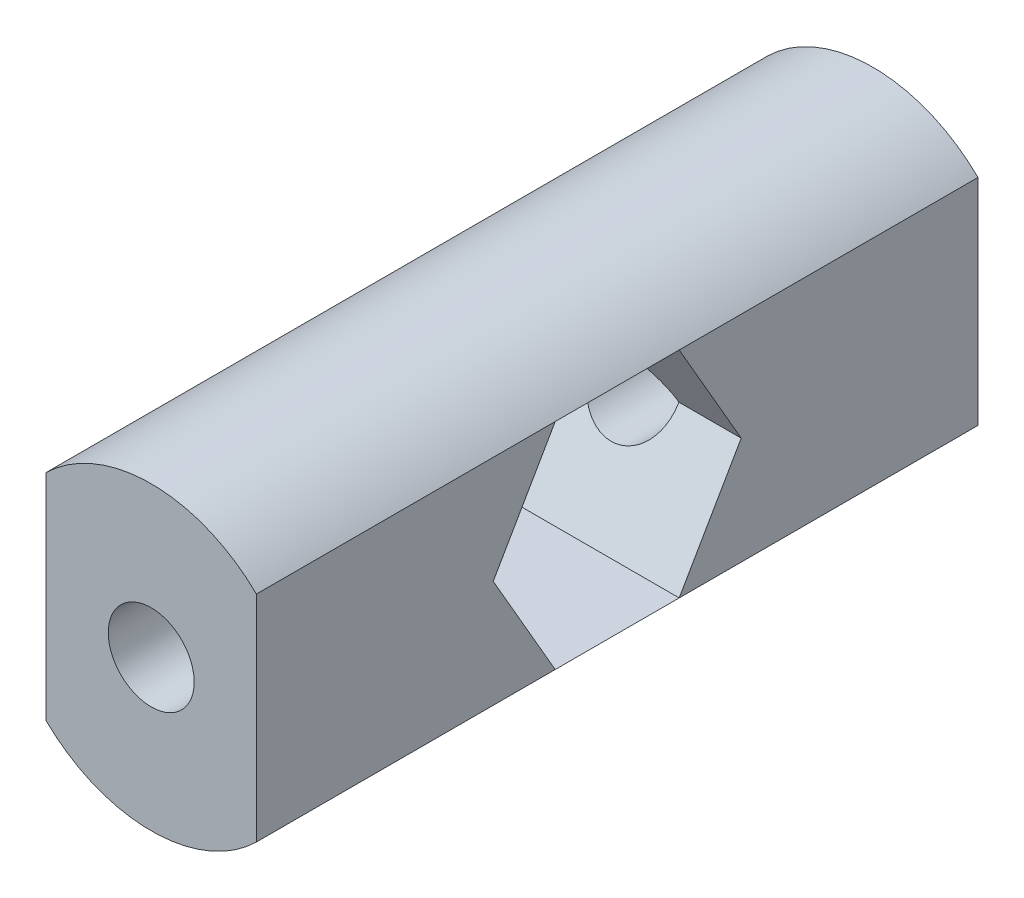
from build123d import *

# Parameters (mm, degrees)
SKETCH1_R           = 17.5
BOSS_EXTRUDE1_DEPTH = 42
SKETCH3_W           = 21.176447949
SKETCH3_H           = 25
CUT_EXTRUDE1_DEPTH  = 88.569972022
SKETCH4_R           = 5
CUT_EXTRUDE2_DEPTH  = 87.67323693
CUT_EXTRUDE3_DEPTH  = 74


with BuildPart() as part:
    # Sketch1 → Boss-Extrude1 (new, symmetric)
    with BuildSketch(Plane.XY):
        with Locations(Location((0, 0, 0), (0, 0, 180))):
            Circle(SKETCH1_R)
    extrude(amount=BOSS_EXTRUDE1_DEPTH, both=True)

    # Sketch3 → Cut-Extrude1 (cut, through all)
    with BuildSketch(Plane.XY.offset(42)):
        with Locations((-22.835672689, 0)):
            Rectangle(SKETCH3_W, SKETCH3_H)
        with Locations((22.835672689, 0)):
            Rectangle(SKETCH3_W, SKETCH3_H)
    extrude(amount=-CUT_EXTRUDE1_DEPTH, mode=Mode.SUBTRACT)

    # Sketch4 → Cut-Extrude2 (cut, through all)
    with BuildSketch(Plane.XY.offset(42)):
        Circle(SKETCH4_R)
    extrude(amount=-CUT_EXTRUDE2_DEPTH, mode=Mode.SUBTRACT)

    # Sketch5 → Cut-Extrude3 (cut)
    with BuildSketch(Plane(origin=(12.247448714, 0, 0), x_dir=(0, 0, -1), z_dir=(1, 0, 0))):
        Polygon((14.43375673, 0), (7.216878365, 12.5), (-7.216878365, 12.5), (-14.43375673, 0), (-7.216878365, -12.5), (7.216878365, -12.5), align=None)
    extrude(amount=-CUT_EXTRUDE3_DEPTH, mode=Mode.SUBTRACT)


solid = part.part
